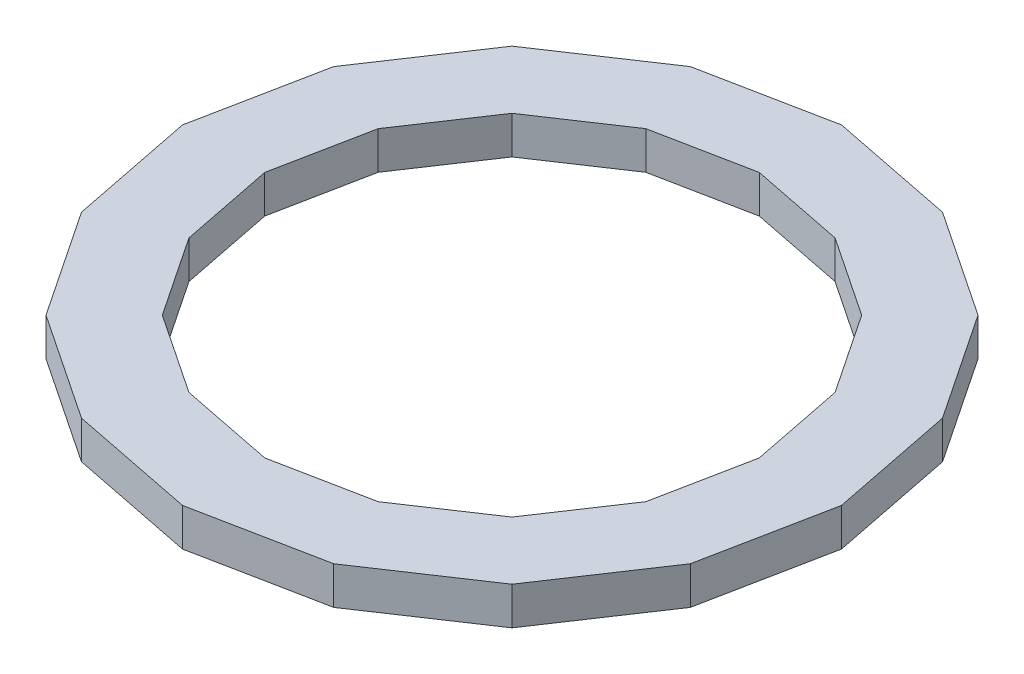
from build123d import *

# Parameters (mm, degrees)
BOSS_EXTRUDE1_DEPTH = 19.05


with BuildPart() as part:
    # Sketch1 → Boss-Extrude1 (new body)
    with BuildSketch(Plane(origin=(0, 0, 0), x_dir=(1, 0, 0), z_dir=(0, 1, 0))):
        Polygon((166.00003355, 0), (153.364033393, 63.525462612), (117.379749401, 117.379749401), (63.525462612, 153.364033393), (0, 166.00003355), (-63.525462612, 153.364033393), (-117.379749401, 117.379749401), (-153.364033393, 63.525462612), (-166.00003355, 0), (-153.364033393, -63.525462612), (-117.379749401, -117.379749401), (-63.525462612, -153.364033393), (0, -166.00003355), (63.525462612, -153.364033393), (117.379749401, -117.379749401), (153.364033393, -63.525462612), align=None)
        Polygon((124.563848881, 0), (115.081990472, 47.668521238), (88.079942234, 88.079942234), (47.668521238, 115.081990472), (0, 124.563848881), (-47.668521238, 115.081990472), (-88.079942234, 88.079942234), (-115.081990472, 47.668521238), (-124.563848881, 0), (-115.081990472, -47.668521238), (-88.079942234, -88.079942234), (-47.668521238, -115.081990472), (0, -124.563848881), (47.668521238, -115.081990472), (88.079942234, -88.079942234), (115.081990472, -47.668521238), align=None, mode=Mode.SUBTRACT)
    extrude(amount=BOSS_EXTRUDE1_DEPTH)


solid = part.part
